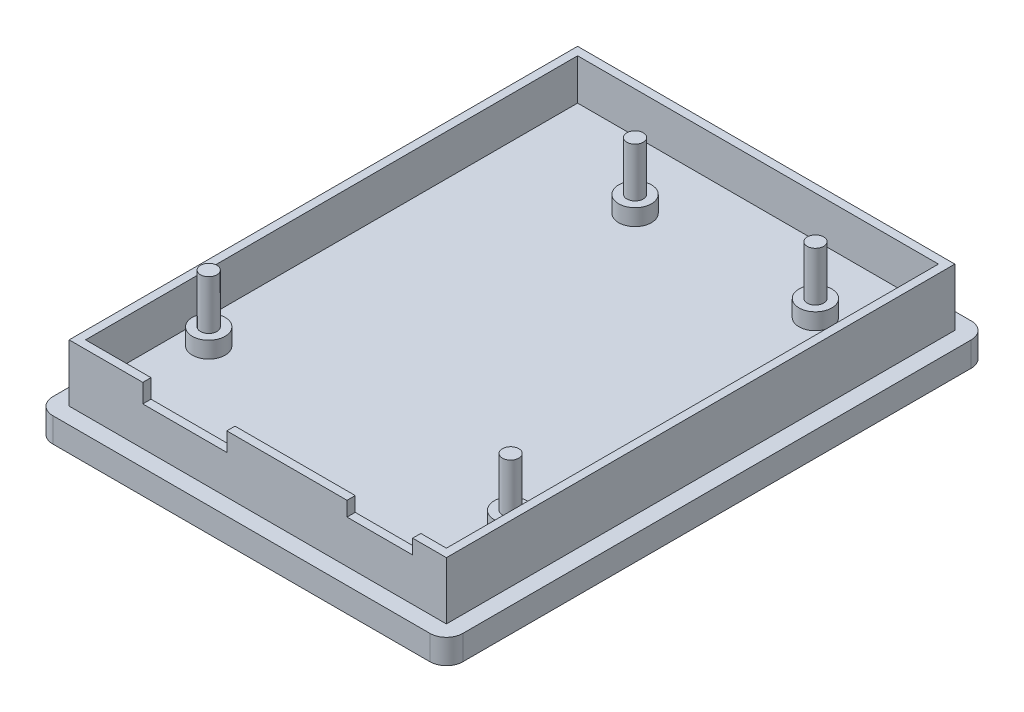
from build123d import *

# Parameters (mm, degrees)
SKETCH1_W           = 63.5
SKETCH1_H           = 83.82
BOSS_EXTRUDE1_DEPTH = 12.7
SKETCH2_W           = 55.88
SKETCH2_H           = 76.2
CUT_EXTRUDE1_DEPTH  = 6.35
SKETCH3_W           = 63.5
SKETCH3_H           = 83.82
SKETCH3_W_2         = 58.42
SKETCH3_H_2         = 78.74
CUT_EXTRUDE2_DEPTH  = 8.89
SKETCH6_R           = 1.27
BOSS_EXTRUDE3_DEPTH = 10.16
SKETCH8_R           = 2.54
BOSS_EXTRUDE4_DEPTH = 2.54
SKETCH10_W          = 13.010391052
SKETCH10_H          = 3.325331773
CUT_EXTRUDE4_DEPTH  = 10.16
SKETCH11_W          = 10.16
SKETCH11_H          = 2.62905351
CUT_EXTRUDE5_DEPTH  = 10.16
FILLET1_R           = 2.54


with BuildPart() as part:
    # Sketch1 → Boss-Extrude1 (new body)
    with BuildSketch(Plane(origin=(0, 0, 0), x_dir=(1, 0, 0), z_dir=(0, 1, 0))):
        Rectangle(SKETCH1_W, SKETCH1_H)
    extrude(amount=BOSS_EXTRUDE1_DEPTH)

    # Sketch2 → Cut-Extrude1 (cut)
    with BuildSketch(Plane(origin=(0, 12.7, 0), x_dir=(1, 0, 0), z_dir=(0, 1, 0))):
        Rectangle(SKETCH2_W, SKETCH2_H)
    extrude(amount=-CUT_EXTRUDE1_DEPTH, mode=Mode.SUBTRACT)

    # Sketch3 → Cut-Extrude2 (cut)
    with BuildSketch(Plane(origin=(0, 12.7, 0), x_dir=(1, 0, 0), z_dir=(0, 1, 0))):
        Rectangle(SKETCH3_W, SKETCH3_H)
        Rectangle(SKETCH3_W_2, SKETCH3_H_2, mode=Mode.SUBTRACT)
    extrude(amount=-CUT_EXTRUDE2_DEPTH, mode=Mode.SUBTRACT)

    # Sketch6 → Boss-Extrude3 (add)
    with BuildSketch(Plane(origin=(0, 6.35, 0), x_dir=(1, 0, 0), z_dir=(0, 1, 0))):
        with Locations(Location((-23.958920987, -23.008465221, 0), (0, 0, 270))):
            Circle(SKETCH6_R)
        with Locations(Location((-8.718920987, 27.778834779, 0), (0, 0, 270))):
            Circle(SKETCH6_R)
        with Locations(Location((19.208379013, 27.778834779, 0), (0, 0, 270))):
            Circle(SKETCH6_R)
        with Locations(Location((24.012870789, -24.225811214, 0), (0, 0, 270))):
            Circle(SKETCH6_R)
    extrude(amount=BOSS_EXTRUDE3_DEPTH)

    # Sketch8 → Boss-Extrude4 (add)
    with BuildSketch(Plane(origin=(0, 6.35, 0), x_dir=(1, 0, 0), z_dir=(0, 1, 0))):
        with Locations(Location((19.208379013, 27.778834779, 0), (0, 0, 270))):
            Circle(SKETCH8_R)
        with Locations(Location((-8.718920987, 27.778834779, 0), (0, 0, 270))):
            Circle(SKETCH8_R)
        with Locations(Location((-23.958920987, -23.008465221, 0), (0, 0, 270))):
            Circle(SKETCH8_R)
        with Locations(Location((24.012870789, -24.225811214, 0), (0, 0, 270))):
            Circle(SKETCH8_R)
    extrude(amount=BOSS_EXTRUDE4_DEPTH)

    # Sketch10 → Cut-Extrude4 (cut)
    with BuildSketch(Plane.XY.offset(39.37)):
        with Locations((-11.303612935, 11.47098091)):
            Rectangle(SKETCH10_W, SKETCH10_H)
    extrude(amount=-CUT_EXTRUDE4_DEPTH, mode=Mode.SUBTRACT)

    # Sketch11 → Cut-Extrude5 (cut)
    with BuildSketch(Plane.XY.offset(39.37)):
        with Locations((18.901215122, 11.759143512)):
            Rectangle(SKETCH11_W, SKETCH11_H)
    extrude(amount=-CUT_EXTRUDE5_DEPTH, mode=Mode.SUBTRACT)

    # Fillet1
    fillet1_edges = [part.edges().sort_by_distance(p)[0] for p in [
        (31.75, 1.905, 41.91),
        (-31.75, 1.905, 41.91),
        (-31.75, 1.905, -41.91),
        (31.75, 1.905, -41.91),
    ]]
    fillet(fillet1_edges, radius=FILLET1_R)


solid = part.part
